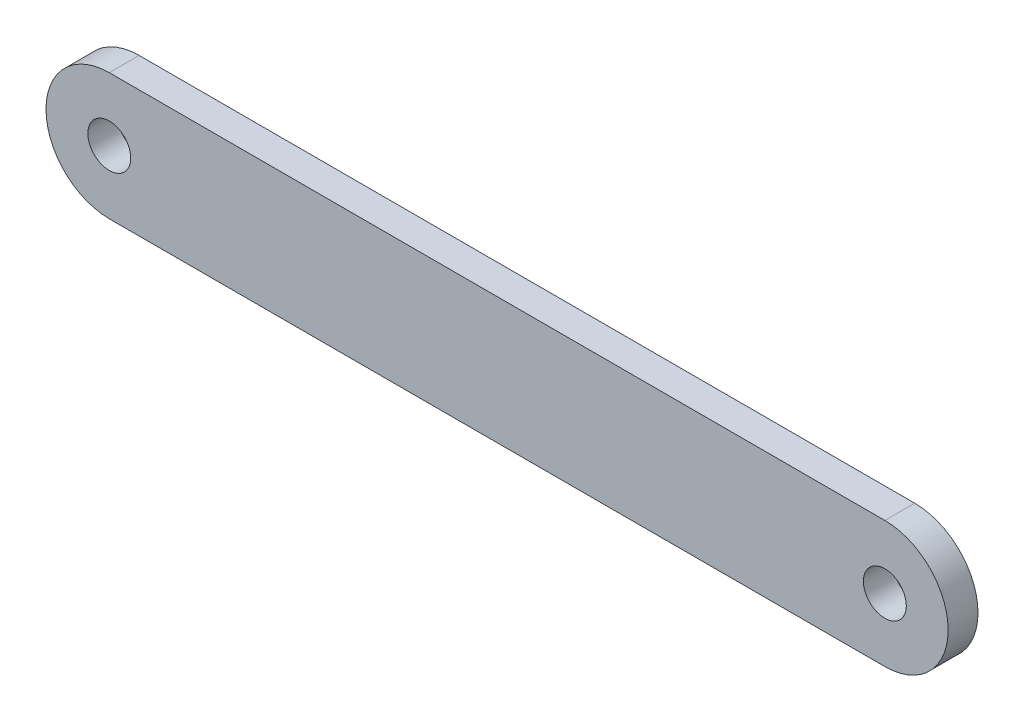
from build123d import *

# Parameters (mm, degrees)
BOSS_EXTRUDE1_DEPTH       = 2.9972
F_8_CLEARANCE_HOLE1_D     = 4.3053
F_8_CLEARANCE_HOLE1_DEPTH = 6.351016


with BuildPart() as part:
    # Sketch1 → Boss-Extrude1 (new body)
    with BuildSketch(Plane.XY):
        with BuildLine():
            Line((-38.9128, 6.35), (38.9128, 6.35))
            ThreePointArc((38.9128, 6.35), (45.2628, 0), (38.9128, -6.35))
            Line((38.9128, -6.35), (-38.9128, -6.35))
            ThreePointArc((-38.9128, -6.35), (-45.2628, 0), (-38.9128, 6.35))
        make_face()
    extrude(amount=BOSS_EXTRUDE1_DEPTH)

    # #8 Clearance Hole1
    with Locations(Plane.XY.offset(2.9972)):
        with Locations((-38.9128, 0), (38.9128, 0)):
            Hole(F_8_CLEARANCE_HOLE1_D / 2, depth=F_8_CLEARANCE_HOLE1_DEPTH)


solid = part.part
